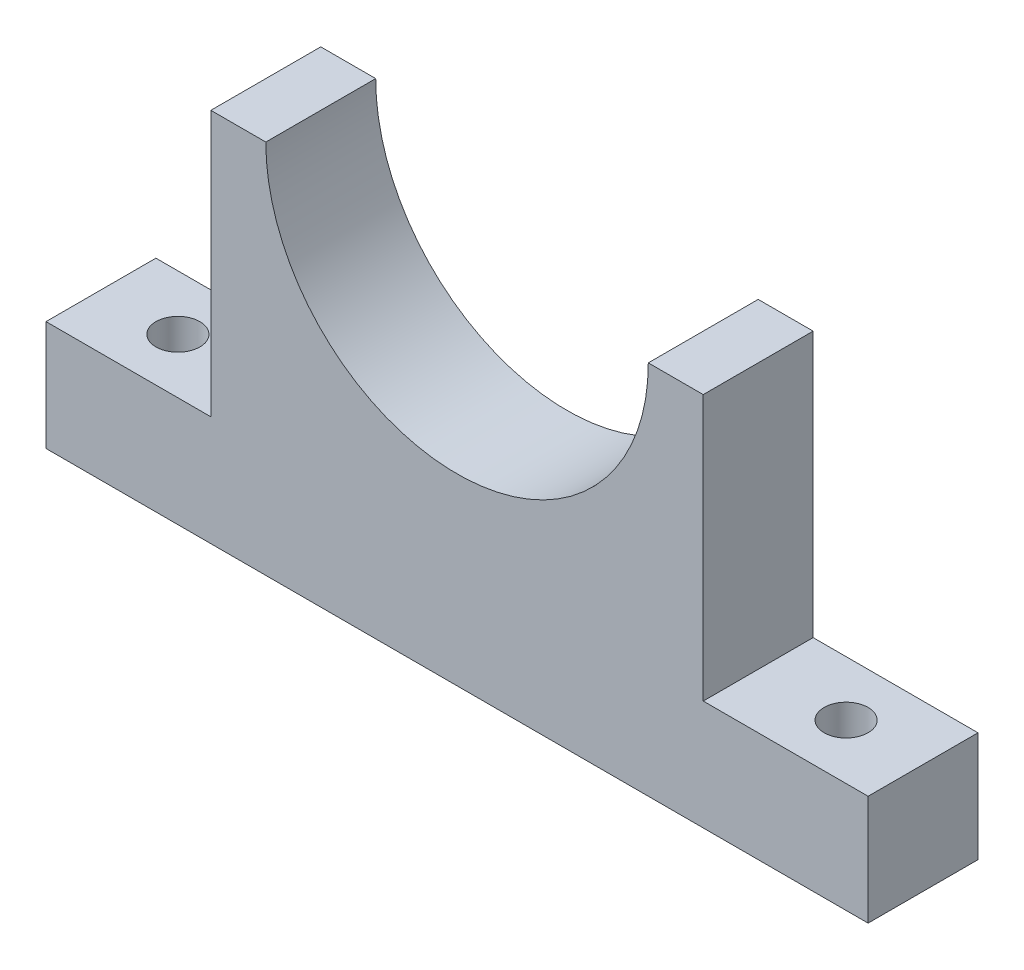
from build123d import *

# Parameters (mm, degrees)
BOSS_EXTRU_1_DEPTH      = 10
ESQUISSE2_W             = 10
ESQUISSE2_H             = 10
BOSS_EXTRU_2_DEPTH      = 15
ESQUISSE3_W             = 10
ESQUISSE3_H             = 10
BOSS_EXTRU_3_DEPTH      = 15
ESQUISSE4_R             = 2
ENL_V_MAT_EXTRU_1_DEPTH = 20


with BuildPart() as part:
    # Esquisse1 → Boss.-Extru.1 (new body)
    with BuildSketch(Plane.XY):
        with BuildLine():
            Line((-22.399928161, 17.075), (-17.399928161, 17.075))
            ThreePointArc((-17.399928161, 17.075), (0, -0.375), (17.399928161, 17.075))
            Line((17.399928161, 17.075), (22.399928161, 17.075))
            Line((22.399928161, 17.075), (22.399928161, -17.075))
            Line((22.399928161, -17.075), (-22.399928161, -17.075))
            Line((-22.399928161, -17.075), (-22.399928161, 17.075))
        make_face()
    extrude(amount=BOSS_EXTRU_1_DEPTH)

    # Esquisse2 → Boss.-Extru.2 (add)
    with BuildSketch(Plane.ZY.offset(22.399928161)):
        with Locations((5, -12.075)):
            Rectangle(ESQUISSE2_W, ESQUISSE2_H)
    extrude(amount=BOSS_EXTRU_2_DEPTH)

    # Esquisse3 → Boss.-Extru.3 (add)
    with BuildSketch(Plane(origin=(22.399928161, 0, 0), x_dir=(0, 0, -1), z_dir=(1, 0, 0))):
        with Locations((-5, -12.075)):
            Rectangle(ESQUISSE3_W, ESQUISSE3_H)
    extrude(amount=BOSS_EXTRU_3_DEPTH)

    # Esquisse4 → Enlèv. mat.-Extru.1 (cut)
    with BuildSketch(Plane(origin=(0, -7.075, 0), x_dir=(1, 0, 0), z_dir=(0, 1, 0))):
        with Locations(Location((-30.399928161, -5, 0), (0, 0, 180))):
            Circle(ESQUISSE4_R)
        with Locations(Location((30.399928161, -5, 0), (0, 0, 270))):
            Circle(ESQUISSE4_R)
    extrude(amount=-ENL_V_MAT_EXTRU_1_DEPTH, mode=Mode.SUBTRACT)


solid = part.part
